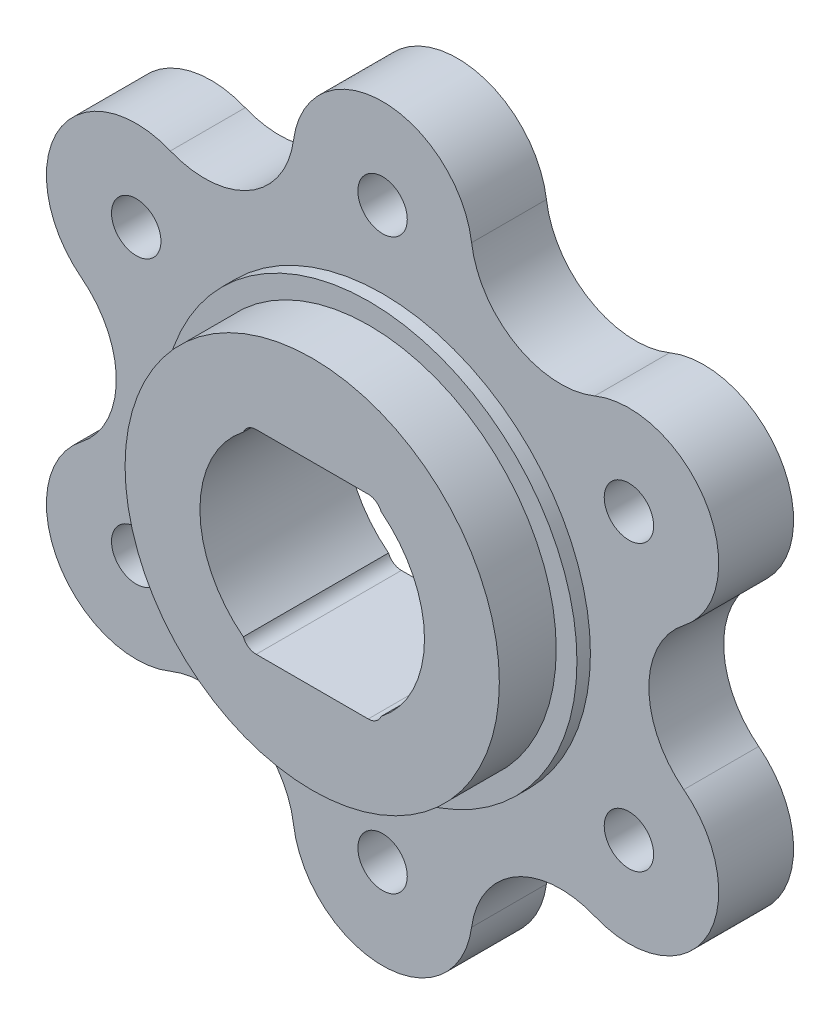
from build123d import *

# Parameters (mm, degrees)
EXTRUDE_1_DEPTH     = 5
SKETCH_1_3_R        = 13.883
EXTRUDE_2_DEPTH     = 5.9
SKETCH_1_4_R        = 12.5
EXTRUDE_3_DEPTH     = 9.7
CUT_EXTRUDE_1_DEPTH = 35.975617108
M4X0_7_1_D          = 3.3
SKETCH_5_R          = 0.92977942
CUT_EXTRUDE_2_DEPTH = 35.975617108


with BuildPart() as part:
    # ｽｹｯﾁ1 → ﾎﾞｽ - 押し出し1 (new body)
    with BuildSketch(Plane.XY):
        with BuildLine():
            ThreePointArc((5.946480455, 19.799606275), (0, 25), (-5.946480455, 19.799606275))
            ThreePointArc((-5.946480455, 19.799606275), (-8.892960911, 15.403060127), (-14.173721791, 15.049606275))
            ThreePointArc((-14.173721791, 15.049606275), (-21.650635095, 12.5), (-20.120202247, 4.75))
            ThreePointArc((-20.120202247, 4.75), (-17.785921821, 0), (-20.120202247, -4.75))
            ThreePointArc((-20.120202247, -4.75), (-21.650635095, -12.5), (-14.173721791, -15.049606275))
            ThreePointArc((-14.173721791, -15.049606275), (-8.892960911, -15.403060127), (-5.946480455, -19.799606275))
            ThreePointArc((-5.946480455, -19.799606275), (0, -25), (5.946480455, -19.799606275))
            ThreePointArc((5.946480455, -19.799606275), (8.892960911, -15.403060127), (14.173721791, -15.049606275))
            ThreePointArc((14.173721791, -15.049606275), (21.650635095, -12.5), (20.120202247, -4.75))
            ThreePointArc((20.120202247, -4.75), (17.785921821, 0), (20.120202247, 4.75))
            ThreePointArc((20.120202247, 4.75), (21.650635095, 12.5), (14.173721791, 15.049606275))
            ThreePointArc((14.173721791, 15.049606275), (8.892960911, 15.403060127), (5.946480455, 19.799606275))
        make_face()
    extrude(amount=EXTRUDE_1_DEPTH)

    # ｽｹｯﾁ1<3> → ﾎﾞｽ - 押し出し2 (add)
    with BuildSketch(Plane.XY):
        Circle(SKETCH_1_3_R)
    extrude(amount=EXTRUDE_2_DEPTH)

    # ｽｹｯﾁ1<4> → ﾎﾞｽ - 押し出し3 (add)
    with BuildSketch(Plane.XY):
        Circle(SKETCH_1_4_R)
    extrude(amount=EXTRUDE_3_DEPTH)

    # ｽｹｯﾁ1<5> → ｶｯﾄ - 押し出し1 (cut, through all)
    with BuildSketch(Plane.XY):
        with BuildLine():
            Line((-3.741657387, 6.5), (3.741657387, 6.5))
            ThreePointArc((3.741657387, 6.5), (7.5, 0), (3.741657387, -6.5))
            Line((3.741657387, -6.5), (-3.741657387, -6.5))
            ThreePointArc((-3.741657387, -6.5), (-7.5, 0), (-3.741657387, 6.5))
        make_face()
    extrude(amount=CUT_EXTRUDE_1_DEPTH, mode=Mode.SUBTRACT)

    # M4x0.7 ねじ穴1 (through all)
    with Locations(Plane(origin=(0, 19, 0), x_dir=(-1, 0, 0), z_dir=(0, 0, -1))):
        with Locations((0, 0), (-16.454482672, -9.5), (-16.454482672, -28.5), (0, -38), (16.454482672, -28.5), (16.454482672, -9.5)):
            Hole(M4X0_7_1_D / 2)

    # ｽｹｯﾁ5 → ｶｯﾄ - 押し出し2 (cut, through all)
    with BuildSketch(Plane.XY.offset(9.7)):
        with Locations((3.741657387, 5.57022058)):
            Circle(SKETCH_5_R)
        with Locations((3.741657387, -5.57022058)):
            Circle(SKETCH_5_R)
        with Locations((-3.741657387, -5.57022058)):
            Circle(SKETCH_5_R)
        with Locations((-3.741657387, 5.57022058)):
            Circle(SKETCH_5_R)
    extrude(amount=-CUT_EXTRUDE_2_DEPTH, mode=Mode.SUBTRACT)


solid = part.part
